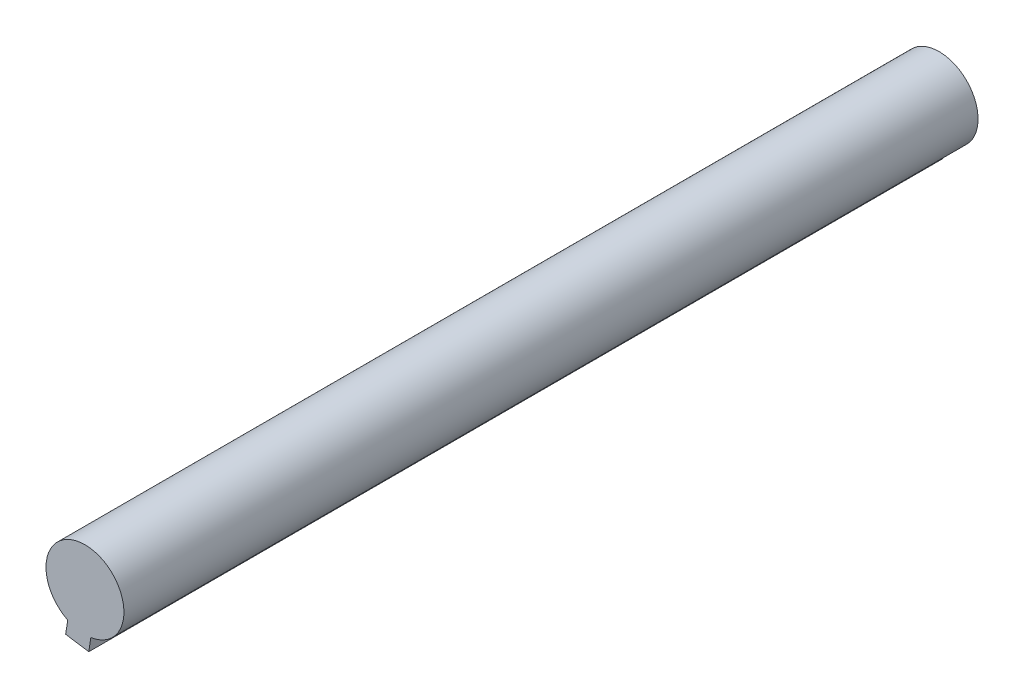
from build123d import *

# Parameters (mm, degrees)
BOSS_EXTRUDE1_DEPTH = 173.99


with BuildPart() as part:
    # Sketch1 → Boss-Extrude1 (new body)
    with BuildSketch(Plane.XY):
        with BuildLine():
            Line((-3.512267681, -7.118137537), (-3.932748357, -9.832621394))
            Line((-3.932748357, -9.832621394), (0.773622087, -10.561650533))
            Line((0.773622087, -10.561650533), (1.194102764, -7.847166676))
            ThreePointArc((1.194102764, -7.847166676), (1.215048565, 7.843950741), (-3.512267681, -7.118137537))
        make_face()
    extrude(amount=BOSS_EXTRUDE1_DEPTH)


solid = part.part
